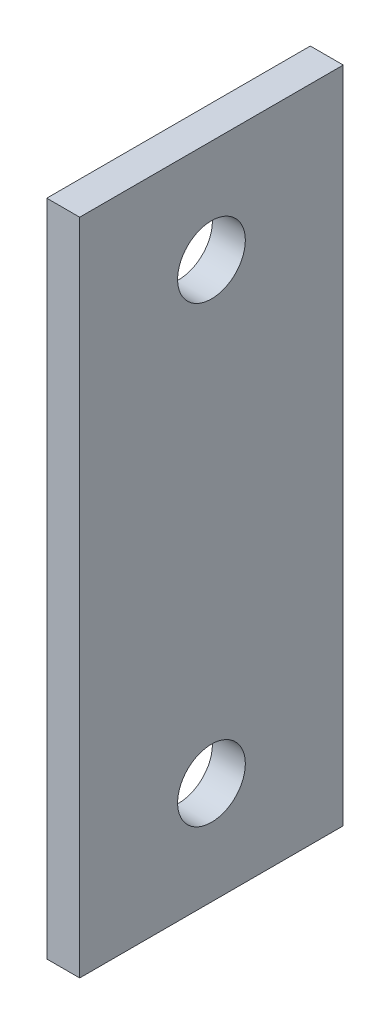
from build123d import *

# Parameters (mm, degrees)
SKETCH2_W           = 25.4
SKETCH2_H           = 63.5
SKETCH2_R           = 3.2639
BOSS_EXTRUDE1_DEPTH = 3.175


with BuildPart() as part:
    # Sketch2 → Boss-Extrude1 (new body)
    with BuildSketch(Plane(origin=(0, 0, 0), x_dir=(0, 0, -1), z_dir=(1, 0, 0))):
        Rectangle(SKETCH2_W, SKETCH2_H)
        with Locations((0, 21.844)):
            Circle(SKETCH2_R, mode=Mode.SUBTRACT)
        with Locations((0, -21.844)):
            Circle(SKETCH2_R, mode=Mode.SUBTRACT)
    extrude(amount=BOSS_EXTRUDE1_DEPTH)


solid = part.part
